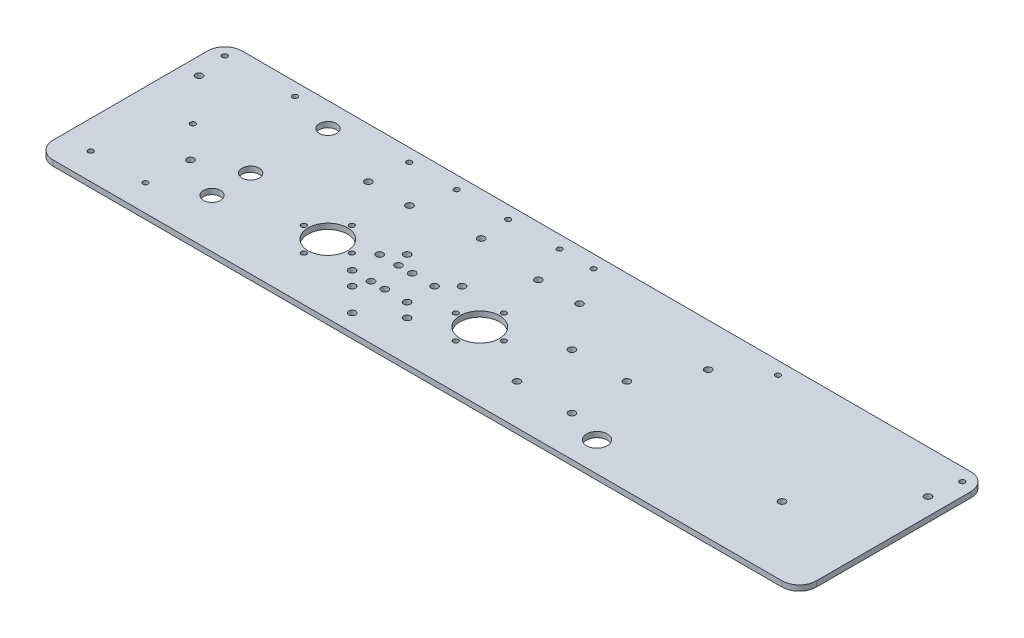
from build123d import *

# Parameters (mm, degrees)
SKETCH1_R           = 2
SKETCH1_R_2         = 1.5
SKETCH1_R_3         = 11.5
SKETCH1_R_4         = 6
BOSS_EXTRUDE1_DEPTH = 3.175
FILLET1_R           = 10
SKETCH2_R           = 2
CUT_EXTRUDE1_DEPTH  = 10
SKETCH3_R           = 2
CUT_EXTRUDE2_DEPTH  = 10
SKETCH4_R           = 1.5
SKETCH4_R_2         = 2
CUT_EXTRUDE3_DEPTH  = 6.35
SKETCH5_R           = 5
CUT_EXTRUDE4_DEPTH  = 3.175


with BuildPart() as part:
    # Sketch1 → Boss-Extrude1 (new body)
    with BuildSketch(Plane(origin=(0, 0, 0), x_dir=(1, 0, 0), z_dir=(0, 1, 0))):
        Polygon((417.700422465, 110), (-26.799577535, 110), (-26.799577535, 0), (417.700422465, 0), (417.700422465, 17.22815868), align=None)
        with Locations(Location((147.450422465, 10, 0), (0, 0, 270))):
            Circle(SKETCH1_R, mode=Mode.SUBTRACT)
        with Locations(Location((103.200422465, 26, 0), (0, 0, 270))):
            Circle(SKETCH1_R_2, mode=Mode.SUBTRACT)
        with Locations(Location((23.200422465, 40, 0), (0, 0, 270))):
            Circle(SKETCH1_R, mode=Mode.SUBTRACT)
        with Locations(Location((89.200422465, 40, 0), (0, 0, 270))):
            Circle(SKETCH1_R_2, mode=Mode.SUBTRACT)
        with Locations(Location((103.200422465, 40, 0), (0, 0, 270))):
            Circle(SKETCH1_R_3, mode=Mode.SUBTRACT)
        with Locations(Location((117.200422465, 40, 0), (0, 0, 270))):
            Circle(SKETCH1_R_2, mode=Mode.SUBTRACT)
        with Locations(Location((177.700422465, 40, 0), (0, 0, 270))):
            Circle(SKETCH1_R_2, mode=Mode.SUBTRACT)
        with Locations(Location((191.700422465, 26, 0), (0, 0, 270))):
            Circle(SKETCH1_R_2, mode=Mode.SUBTRACT)
        with Locations(Location((191.700422465, 40, 0), (0, 0, 270))):
            Circle(SKETCH1_R_3, mode=Mode.SUBTRACT)
        with Locations(Location((205.700422465, 40, 0), (0, 0, 270))):
            Circle(SKETCH1_R_2, mode=Mode.SUBTRACT)
        with Locations(Location((103.200422465, 54, 0), (0, 0, 270))):
            Circle(SKETCH1_R_2, mode=Mode.SUBTRACT)
        with Locations(Location((191.700422465, 54, 0), (0, 0, 270))):
            Circle(SKETCH1_R_2, mode=Mode.SUBTRACT)
        with Locations(Location((282.700422465, 17.22815868, 0), (0, 0, 270))):
            Circle(SKETCH1_R_4, mode=Mode.SUBTRACT)
        with Locations(Location((367.700422465, 40, 0), (0, 0, 270))):
            Circle(SKETCH1_R, mode=Mode.SUBTRACT)
        with Locations(Location((-16.799577535, 85, 0), (0, 0, 270))):
            Circle(SKETCH1_R, mode=Mode.SUBTRACT)
        with Locations(Location((-19.299577535, 102.5, 0), (0, 0, 270))):
            Circle(SKETCH1_R_2, mode=Mode.SUBTRACT)
        with Locations(Location((147.450422465, 85, 0), (0, 0, 270))):
            Circle(SKETCH1_R, mode=Mode.SUBTRACT)
        with Locations(Location((88.075422465, 102.5, 0), (0, 0, 270))):
            Circle(SKETCH1_R_2, mode=Mode.SUBTRACT)
        with Locations(Location((279.700422465, 85, 0), (0, 0, 270))):
            Circle(SKETCH1_R, mode=Mode.SUBTRACT)
        with Locations(Location((195.450422465, 102.5, 0), (0, 0, 270))):
            Circle(SKETCH1_R_2, mode=Mode.SUBTRACT)
        with Locations(Location((302.825422465, 102.5, 0), (0, 0, 270))):
            Circle(SKETCH1_R_2, mode=Mode.SUBTRACT)
        with Locations(Location((407.700422465, 85, 0), (0, 0, 270))):
            Circle(SKETCH1_R, mode=Mode.SUBTRACT)
        with Locations(Location((410.200422465, 102.5, 0), (0, 0, 270))):
            Circle(SKETCH1_R_2, mode=Mode.SUBTRACT)
    extrude(amount=BOSS_EXTRUDE1_DEPTH)

    # Fillet1
    fillet1_edges = [part.edges().sort_by_distance(p)[0] for p in [
        (417.700422465, 1.5875, 0),
        (-26.799577535, 1.5875, 0),
        (-26.799577535, 1.5875, -110),
        (417.700422465, 1.5875, -110),
    ]]
    fillet(fillet1_edges, radius=FILLET1_R)

    # Sketch2 → Cut-Extrude1 (cut)
    with BuildSketch(Plane(origin=(0, 3.175, 0), x_dir=(1, 0, 0), z_dir=(0, 1, 0))):
        with Locations(Location((133.950422465, 55.40559892, 0), (0, 0, 270))):
            Circle(SKETCH2_R)
        with Locations(Location((165.950422465, 55.40559892, 0), (0, 0, 270))):
            Circle(SKETCH2_R)
        with Locations(Location((165.950422465, 23.40559892, 0), (0, 0, 270))):
            Circle(SKETCH2_R)
        with Locations(Location((157.950422465, 47.40559892, 0), (0, 0, 270))):
            Circle(SKETCH2_R)
        with Locations(Location((125.950422465, 47.40559892, 0), (0, 0, 270))):
            Circle(SKETCH2_R)
        with Locations(Location((133.950422465, 23.40559892, 0), (0, 0, 270))):
            Circle(SKETCH2_R)
        with Locations(Location((125.950422465, 31.40559892, 0), (0, 0, 270))):
            Circle(SKETCH2_R)
        with Locations(Location((157.950422465, 31.40559892, 0), (0, 0, 270))):
            Circle(SKETCH2_R)
    extrude(amount=-CUT_EXTRUDE1_DEPTH, mode=Mode.SUBTRACT)

    # Sketch3 → Cut-Extrude2 (cut)
    with BuildSketch(Plane.XZ):
        with Locations(Location((136.950422465, -47.40559892, 0), (0, 0, 270))):
            Circle(SKETCH3_R)
        with Locations(Location((144.950422465, -31.40559892, 0), (0, 0, 270))):
            Circle(SKETCH3_R)
        with Locations(Location((136.950422465, -31.40559892, 0), (0, 0, 270))):
            Circle(SKETCH3_R)
        with Locations(Location((144.950422465, -47.40559892, 0), (0, 0, 270))):
            Circle(SKETCH3_R)
        with Locations(Location((229.950422465, -55.40559892, 0), (0, 0, 270))):
            Circle(SKETCH3_R)
        with Locations(Location((229.950422465, -23.40559892, 0), (0, 0, 270))):
            Circle(SKETCH3_R)
        with Locations(Location((261.950422465, -23.40559892, 0), (0, 0, 270))):
            Circle(SKETCH3_R)
        with Locations(Location((261.950422465, -55.40559892, 0), (0, 0, 270))):
            Circle(SKETCH3_R)
    extrude(amount=-CUT_EXTRUDE2_DEPTH, mode=Mode.SUBTRACT)

    # Sketch4 → Cut-Extrude3 (cut)
    with BuildSketch(Plane(origin=(0, 3.175, 0), x_dir=(1, 0, 0), z_dir=(0, 1, 0))):
        with Locations(Location((21.590660574, 102.5, 0), (0, 0, 270))):
            Circle(SKETCH4_R)
        with Locations(Location((5.664827234, 58.95279946, 0), (0, 0, 270))):
            Circle(SKETCH4_R)
        with Locations(Location((-10.261006106, 15.40559892, 0), (0, 0, 270))):
            Circle(SKETCH4_R)
        with Locations(Location((47.350422465, 50.90559892, 0), (0, 0, 270))):
            Circle(SKETCH4_R_2)
        with Locations(Location((115.670834955, 102.5, 0), (0, 0, 270))):
            Circle(SKETCH4_R)
        with Locations(Location((145.670834955, 102.5, 0), (0, 0, 270))):
            Circle(SKETCH4_R)
        with Locations(Location((175.670834955, 102.5, 0), (0, 0, 270))):
            Circle(SKETCH4_R)
        with Locations(Location((47.350422465, 95.90559892, 0), (0, 0, 270))):
            Circle(SKETCH4_R_2)
        with Locations(Location((21.590660574, 15.40559892, 0), (0, 0, 270))):
            Circle(SKETCH4_R)
        with Locations(Location((47.350422465, 28.40559892, 0), (0, 0, 270))):
            Circle(SKETCH4_R_2)
        with Locations(Location((208.950422465, 80.80559892, 0), (0, 0, 270))):
            Circle(SKETCH4_R_2)
        with Locations(Location((184.950422465, 80.80559892, 0), (0, 0, 270))):
            Circle(SKETCH4_R_2)
        with Locations(Location((109.950422465, 80.80559892, 0), (0, 0, 270))):
            Circle(SKETCH4_R_2)
        with Locations(Location((85.950422465, 80.80559892, 0), (0, 0, 270))):
            Circle(SKETCH4_R_2)
    extrude(amount=-CUT_EXTRUDE3_DEPTH, mode=Mode.SUBTRACT)

    # Sketch5 → Cut-Extrude4 (cut)
    with BuildSketch(Plane(origin=(0, 3.175, 0), x_dir=(1, 0, 0), z_dir=(0, 1, 0))):
        with Locations(Location((47.350422465, 95.90559892, 0), (0, 0, 270))):
            Circle(SKETCH5_R)
        with Locations(Location((47.350422465, 50.90559892, 0), (0, 0, 270))):
            Circle(SKETCH5_R)
        with Locations(Location((47.350422465, 28.40559892, 0), (0, 0, 270))):
            Circle(SKETCH5_R)
    extrude(amount=-CUT_EXTRUDE4_DEPTH, mode=Mode.SUBTRACT)


solid = part.part
